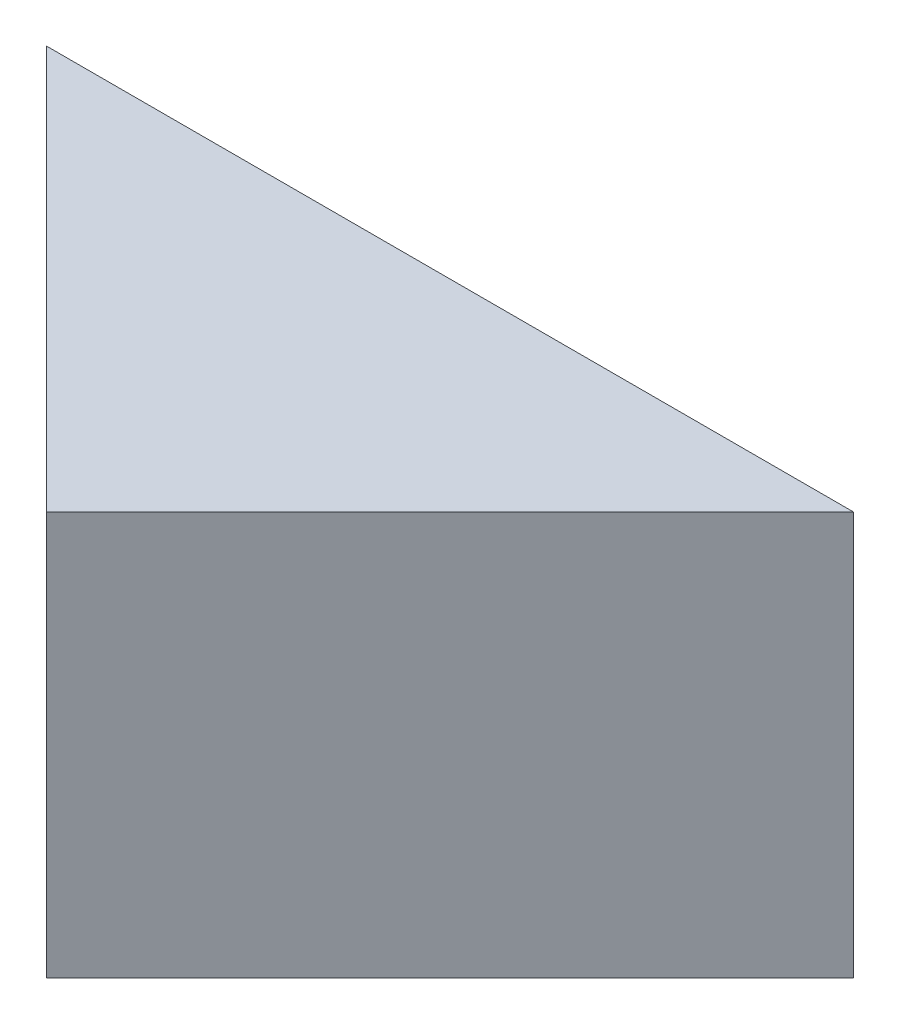
from build123d import *

# Parameters (mm, degrees)
BOSS_EXTRUDE1_DEPTH = 20


with BuildPart() as part:
    # Sketch1 → Boss-Extrude1 (new body)
    with BuildSketch(Plane(origin=(0, 0, 0), x_dir=(1, 0, 0), z_dir=(0, 1, 0))):
        Polygon((-20, 0), (20, 0), (0, -20), align=None)
    extrude(amount=BOSS_EXTRUDE1_DEPTH)


solid = part.part
